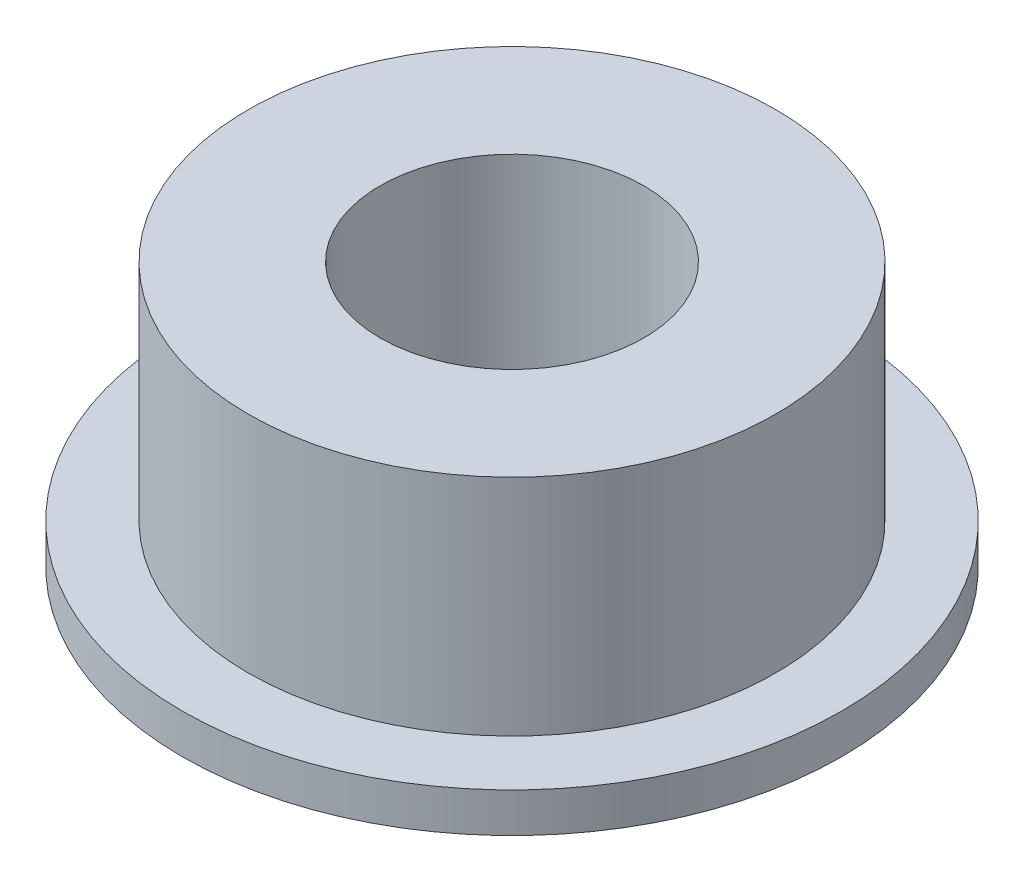
from build123d import *

# Parameters (mm, degrees)
SKETCH_1_R      = 4
SKETCH_1_R_2    = 2
EXTRUDE_1_DEPTH = 3
SKETCH_2_R      = 5
SKETCH_2_R_2    = 2
EXTRUDE_2_DEPTH = 0.6
SKETCH_3_R      = 4
SKETCH_3_R_2    = 2
EXTRUDE_3_DEPTH = 1


with BuildPart() as part:
    # 草图1 → 凸台-拉伸1 (new body)
    with BuildSketch(Plane(origin=(0, 0, 0), x_dir=(1, 0, 0), z_dir=(0, 1, 0))):
        with Locations(Location((0, 0, 0), (0, 0, 270))):
            Circle(SKETCH_1_R)
        with Locations(Location((0, 0, 0), (0, 0, 270))):
            Circle(SKETCH_1_R_2, mode=Mode.SUBTRACT)
    extrude(amount=EXTRUDE_1_DEPTH)

    # 草图2 → 凸台-拉伸2 (add)
    with BuildSketch(Plane.XZ):
        with Locations(Location((0, 0, 0), (0, 0, 270))):
            Circle(SKETCH_2_R)
        with Locations(Location((0, 0, 0), (0, 0, 90))):
            Circle(SKETCH_2_R_2, mode=Mode.SUBTRACT)
    extrude(amount=-EXTRUDE_2_DEPTH)

    # 草图3 → 凸台-拉伸3 (add)
    with BuildSketch(Plane(origin=(0, 3, 0), x_dir=(1, 0, 0), z_dir=(0, 1, 0))):
        with Locations(Location((0, 0, 0), (0, 0, 90))):
            Circle(SKETCH_3_R)
        with Locations(Location((0, 0, 0), (0, 0, 270))):
            Circle(SKETCH_3_R_2, mode=Mode.SUBTRACT)
    extrude(amount=EXTRUDE_3_DEPTH)


solid = part.part
